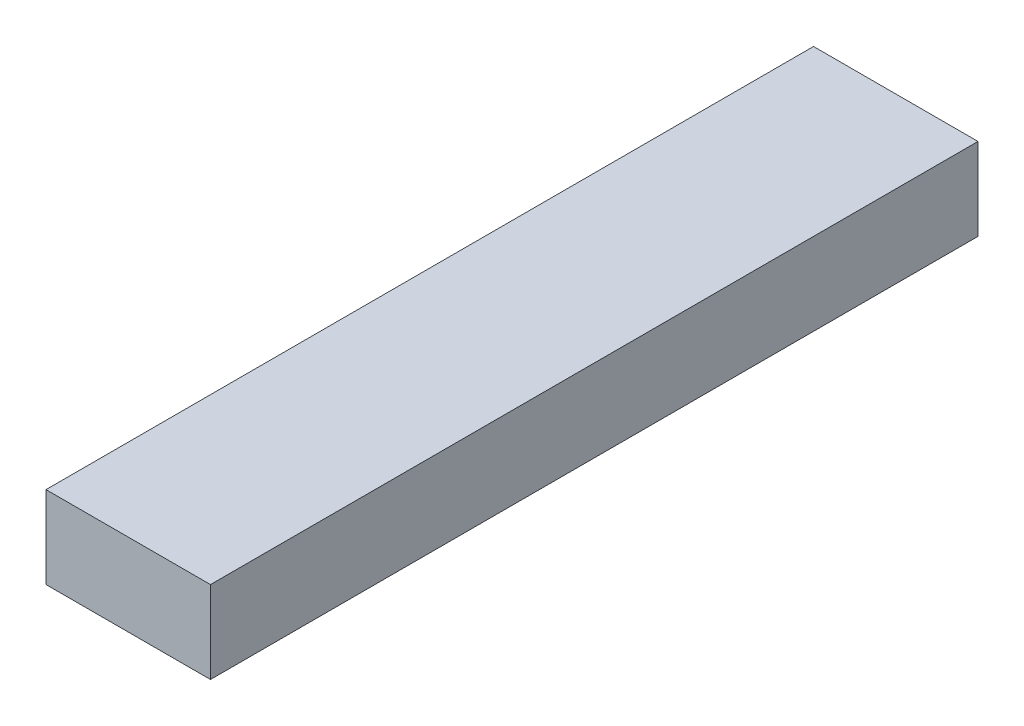
from build123d import *

# Parameters (mm, degrees)
SKETCH2_W           = 9.525
SKETCH2_H           = 4.7625
BOSS_EXTRUDE1_DEPTH = 44.45


with BuildPart() as part:
    # Sketch2 → Boss-Extrude1 (new body)
    with BuildSketch(Plane.XY):
        with Locations((4.7625, 2.38125)):
            Rectangle(SKETCH2_W, SKETCH2_H)
    extrude(amount=-BOSS_EXTRUDE1_DEPTH)


solid = part.part
